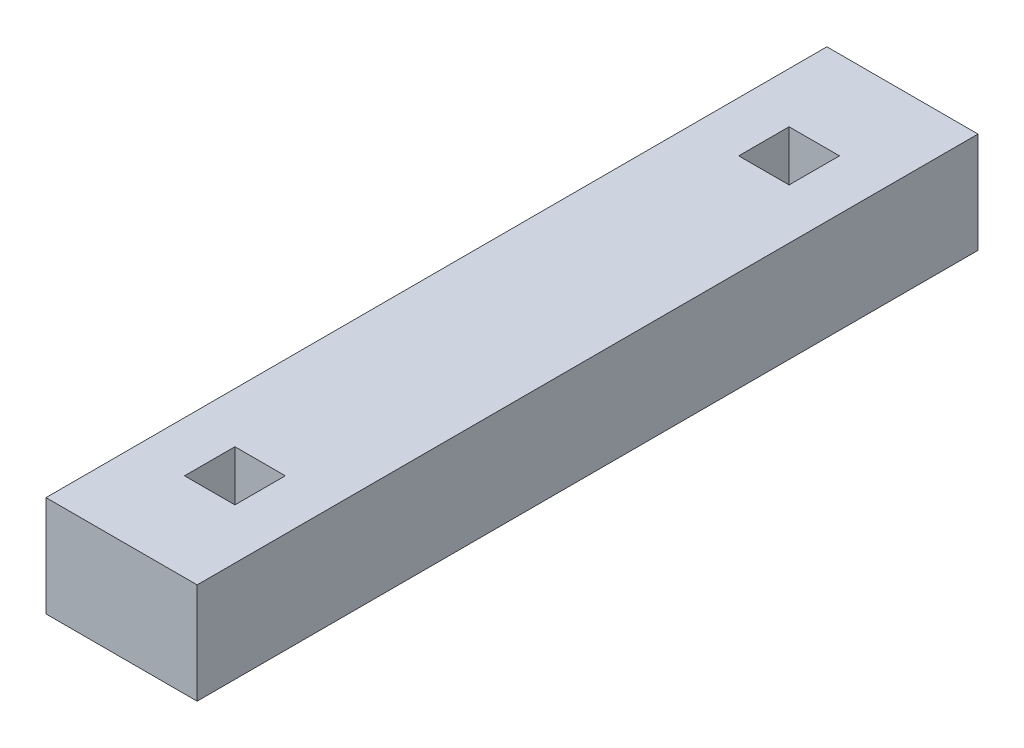
from build123d import *

# Parameters (mm, degrees)
SKETCH1_W           = 30
SKETCH1_H           = 155
SKETCH1_W_2         = 10
SKETCH1_H_2         = 10
BOSS_EXTRUDE1_DEPTH = 20


with BuildPart() as part:
    # Sketch1 → Boss-Extrude1 (new body)
    with BuildSketch(Plane(origin=(0, 0, 0), x_dir=(1, 0, 0), z_dir=(0, 1, 0))):
        with Locations((0, -5)):
            Rectangle(SKETCH1_W, SKETCH1_H)
        with Locations((0, 50)):
            Rectangle(SKETCH1_W_2, SKETCH1_H_2, mode=Mode.SUBTRACT)
        with Locations((0, -60)):
            Rectangle(SKETCH1_W_2, SKETCH1_H_2, mode=Mode.SUBTRACT)
    extrude(amount=BOSS_EXTRUDE1_DEPTH)


solid = part.part
